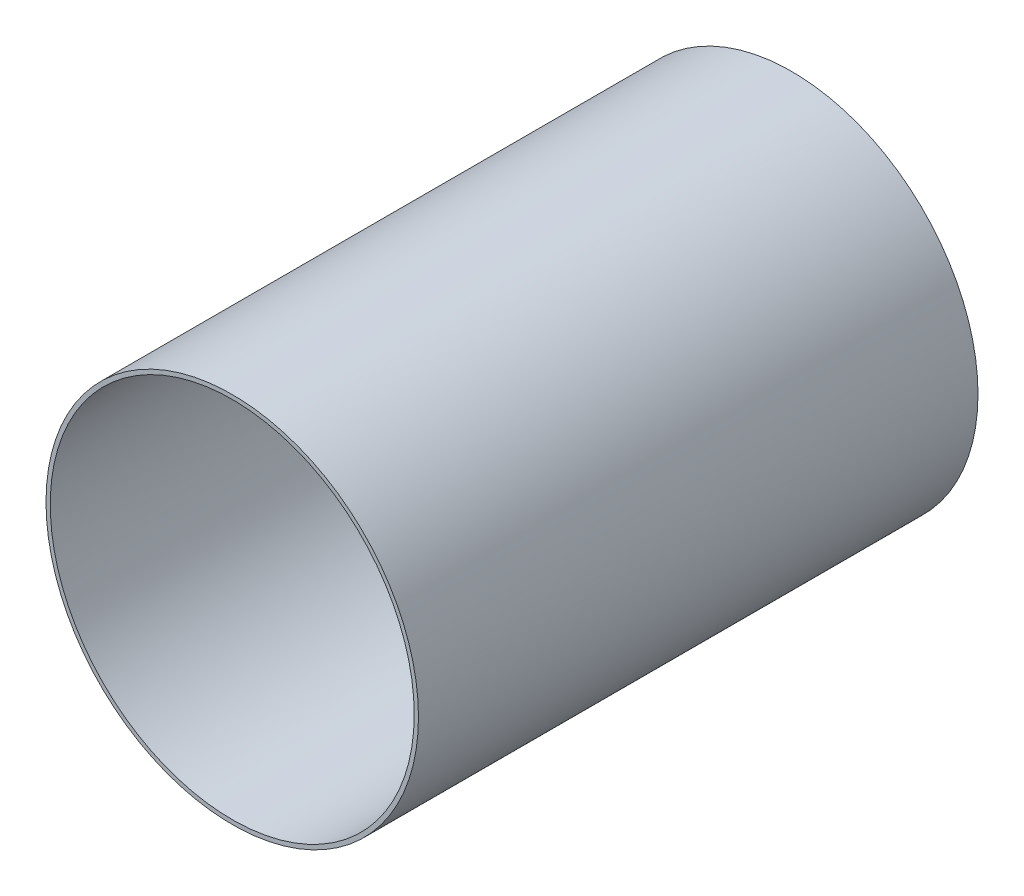
from build123d import *

# Parameters (mm, degrees)
SKETCH1_R           = 49.6697
SKETCH1_R_2         = 48.5394
BOSS_EXTRUDE1_DEPTH = 149.225


with BuildPart() as part:
    # Sketch1 → Boss-Extrude1 (new body)
    with BuildSketch(Plane.XY):
        Circle(SKETCH1_R)
        Circle(SKETCH1_R_2, mode=Mode.SUBTRACT)
    extrude(amount=BOSS_EXTRUDE1_DEPTH)


solid = part.part
